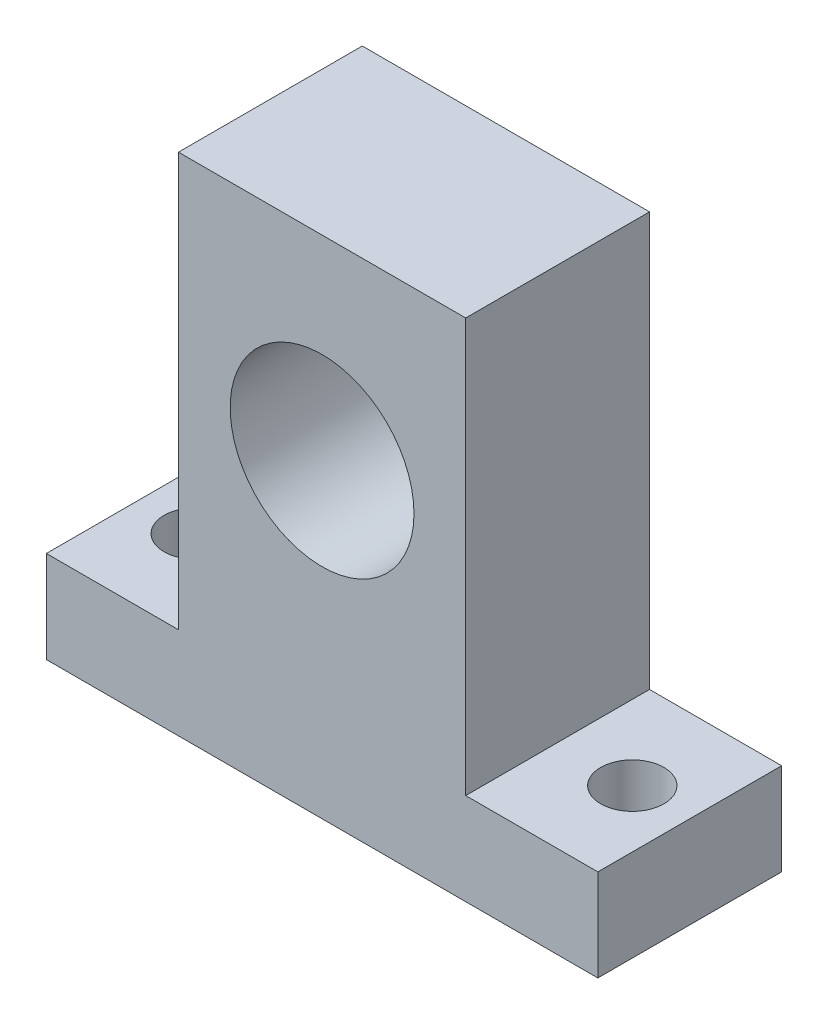
from build123d import *

# Parameters (mm, degrees)
SKETCH_1_R          = 8
EXTRUDE_1_DEPTH     = 8
SKETCH_2_R          = 2.75
CUT_EXTRUDE_1_DEPTH = 45


with BuildPart() as part:
    # 草图1 → 凸台-拉伸1 (new, symmetric)
    with BuildSketch(Plane.XY):
        Polygon((-24, 0), (24, 0), (24, 8), (12.5, 8), (12.5, 44), (-12.5, 44), (-12.5, 8), (-24, 8), align=None)
        with Locations((0, 27)):
            Circle(SKETCH_1_R, mode=Mode.SUBTRACT)
    extrude(amount=EXTRUDE_1_DEPTH, both=True)

    # 草图2 → 切除-拉伸1 (cut, through all)
    with BuildSketch(Plane(origin=(0, 8, 0), x_dir=(1, 0, 0), z_dir=(0, 1, 0))):
        with Locations(Location((19, 0, 0), (0, 0, 270))):
            Circle(SKETCH_2_R)
        with Locations(Location((-19, 0, 0), (0, 0, 90))):
            Circle(SKETCH_2_R)
    extrude(amount=-CUT_EXTRUDE_1_DEPTH, mode=Mode.SUBTRACT)


solid = part.part
